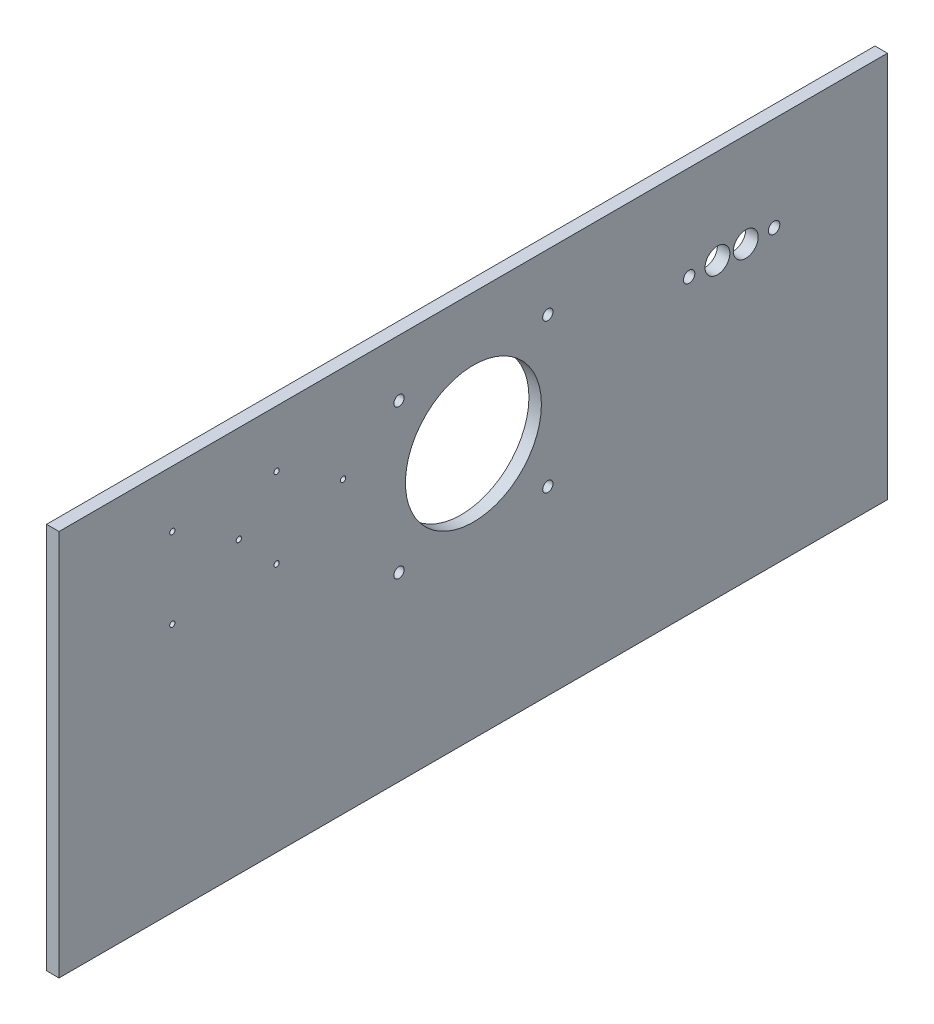
from build123d import *

# Parameters (mm, degrees)
SKETCH1_W             = 278.511
SKETCH1_H             = 129.9972
BOSS_EXTRUDE1_DEPTH   = 4.191
F_2_56_TAPPED_HOLE2_D = 1.778
F_8_32_TAPPED_HOLE1_D = 3.4544
CUT_EXTRUDE1_REACH    = 309.384
SKETCH25_R            = 22.86
CUT_EXTRUDE2_REACH    = 309.384
SKETCH27_R            = 4.1656
SKETCH27_R_2          = 1.905


with BuildPart() as part:
    # Sketch1 → Boss-Extrude1 (new body)
    with BuildSketch(Plane(origin=(0, 0, 0), x_dir=(0, 0, -1), z_dir=(1, 0, 0))):
        with Locations((139.2555, 64.9986)):
            Rectangle(SKETCH1_W, SKETCH1_H)
    extrude(amount=BOSS_EXTRUDE1_DEPTH)

    # #2-56 Tapped Hole2 (through all)
    with Locations(Plane(origin=(4.191, 0, 0), x_dir=(0, 0, -1), z_dir=(1, 0, 0))):
        with Locations((38.1, 83.9724), (38.1, 110.9472), (60.452, 97.4598), (73.152, 110.9472), (73.152, 83.9724), (95.504, 97.4598)):
            Hole(F_2_56_TAPPED_HOLE2_D / 2)

    # #8-32 Tapped Hole1 (through all)
    with Locations(Plane(origin=(4.191, 0, 0), x_dir=(0, 0, -1), z_dir=(1, 0, 0))):
        with Locations((114.3, 60.9092), (114.3, 110.9472), (164.338, 110.9472), (164.338, 60.9092)):
            Hole(F_8_32_TAPPED_HOLE1_D / 2)

    # Sketch25 → Cut-Extrude1 (cut, up to next)
    with BuildSketch(Plane(origin=(4.191, 0, 0), x_dir=(0, 0, -1), z_dir=(1, 0, 0)), mode=Mode.PRIVATE) as cut_extrude1_sk1:
        with Locations((139.319, 85.9282)):
            Circle(SKETCH25_R)
    cut_extrude1_tool1 = extrude(cut_extrude1_sk1.sketch, amount=-CUT_EXTRUDE1_REACH, mode=Mode.PRIVATE) & part.part
    add(cut_extrude1_tool1.solids().sort_by_distance((4.191, 85.9282, -139.319))[0], mode=Mode.SUBTRACT)

    # Sketch27 → Cut-Extrude2 (cut, up to next)
    with BuildSketch(Plane(origin=(4.191, 0, 0), x_dir=(0, 0, -1), z_dir=(1, 0, 0)), mode=Mode.PRIVATE) as cut_extrude2_sk1:
        with Locations((221.361, 98.2472)):
            Circle(SKETCH27_R)
    cut_extrude2_tool1 = extrude(cut_extrude2_sk1.sketch, amount=-CUT_EXTRUDE2_REACH, mode=Mode.PRIVATE) & part.part
    # Sketch27 → Cut-Extrude2 (cut, up to next)
    with BuildSketch(Plane(origin=(4.191, 0, 0), x_dir=(0, 0, -1), z_dir=(1, 0, 0)), mode=Mode.PRIVATE) as cut_extrude2_sk2:
        with Locations((211.836, 98.2472)):
            Circle(SKETCH27_R_2)
    cut_extrude2_tool2 = extrude(cut_extrude2_sk2.sketch, amount=-CUT_EXTRUDE2_REACH, mode=Mode.PRIVATE) & part.part
    # Sketch27 → Cut-Extrude2 (cut, up to next)
    with BuildSketch(Plane(origin=(4.191, 0, 0), x_dir=(0, 0, -1), z_dir=(1, 0, 0)), mode=Mode.PRIVATE) as cut_extrude2_sk3:
        with Locations((230.886, 98.2472)):
            Circle(SKETCH27_R)
    cut_extrude2_tool3 = extrude(cut_extrude2_sk3.sketch, amount=-CUT_EXTRUDE2_REACH, mode=Mode.PRIVATE) & part.part
    # Sketch27 → Cut-Extrude2 (cut, up to next)
    with BuildSketch(Plane(origin=(4.191, 0, 0), x_dir=(0, 0, -1), z_dir=(1, 0, 0)), mode=Mode.PRIVATE) as cut_extrude2_sk4:
        with Locations((240.411, 98.2472)):
            Circle(SKETCH27_R_2)
    cut_extrude2_tool4 = extrude(cut_extrude2_sk4.sketch, amount=-CUT_EXTRUDE2_REACH, mode=Mode.PRIVATE) & part.part
    add(cut_extrude2_tool1.solids().sort_by_distance((4.191, 98.2472, -221.361))[0], mode=Mode.SUBTRACT)
    add(cut_extrude2_tool2.solids().sort_by_distance((4.191, 98.2472, -211.836))[0], mode=Mode.SUBTRACT)
    add(cut_extrude2_tool3.solids().sort_by_distance((4.191, 98.2472, -230.886))[0], mode=Mode.SUBTRACT)
    add(cut_extrude2_tool4.solids().sort_by_distance((4.191, 98.2472, -240.411))[0], mode=Mode.SUBTRACT)


solid = part.part
